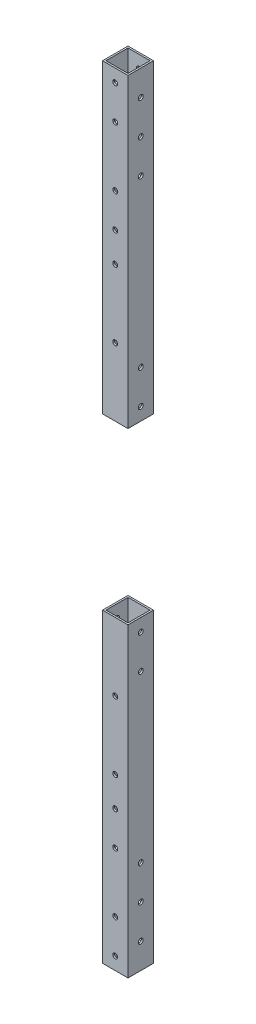
from build123d import *

# Parameters (mm, degrees)
SKETCH_1_W          = 15
SKETCH_1_H          = 15
SKETCH_1_W_2        = 13
SKETCH_1_H_2        = 13
EXTRUDE_1_DEPTH     = 460
SKETCH_2_R          = 1.45
CUT_EXTRUDE_1_DEPTH = 461.305605006
SKETCH_3_R          = 1.45
CUT_EXTRUDE_2_DEPTH = 461.305605006
SKETCH_4_W          = 15
SKETCH_4_H          = 100
CUT_EXTRUDE_3_DEPTH = 461.305605006


with BuildPart() as part:
    # 草图1 → 拉伸-薄壁1 (new body)
    with BuildSketch(Plane(origin=(0, 0, 0), x_dir=(1, 0, 0), z_dir=(0, 1, 0))):
        Rectangle(SKETCH_1_W, SKETCH_1_H)
        Rectangle(SKETCH_1_W_2, SKETCH_1_H_2, mode=Mode.SUBTRACT)
    extrude(amount=EXTRUDE_1_DEPTH)

    # 草图2 → 切除-拉伸1 (cut, through all)
    with BuildSketch(Plane.XY.offset(7.5)):
        with Locations((0, 7.5)):
            Circle(SKETCH_2_R)
        with Locations((0, 27.5)):
            Circle(SKETCH_2_R)
        with Locations(Location((0, 432.5, 0), (0, 0, 180))):
            Circle(SKETCH_2_R)
        with Locations(Location((0, 452.5, 0), (0, 0, 180))):
            Circle(SKETCH_2_R)
        with Locations((0, 62.5)):
            Circle(SKETCH_2_R)
        with Locations((0, 82.5)):
            Circle(SKETCH_2_R)
        with Locations(Location((0, 377.5, 0), (0, 0, 180))):
            Circle(SKETCH_2_R)
        with Locations(Location((0, 397.5, 0), (0, 0, 180))):
            Circle(SKETCH_2_R)
        with Locations((0, 140)):
            Circle(SKETCH_2_R)
        with Locations((0, 100)):
            Circle(SKETCH_2_R)
        with Locations(Location((0, 360, 0), (0, 0, 180))):
            Circle(SKETCH_2_R)
        with Locations(Location((0, 320, 0), (0, 0, 180))):
            Circle(SKETCH_2_R)
    extrude(amount=-CUT_EXTRUDE_1_DEPTH, mode=Mode.SUBTRACT)

    # 草图3 → 切除-拉伸2 (cut, through all)
    with BuildSketch(Plane(origin=(7.5, 0, 0), x_dir=(0, 0, -1), z_dir=(1, 0, 0))):
        with Locations((0, 15)):
            Circle(SKETCH_3_R)
        with Locations((0, 35)):
            Circle(SKETCH_3_R)
        with Locations((0, 425)):
            Circle(SKETCH_3_R)
        with Locations((0, 445)):
            Circle(SKETCH_3_R)
        with Locations((0, 172.5)):
            Circle(SKETCH_3_R)
        with Locations((0, 192.5)):
            Circle(SKETCH_3_R)
        with Locations((0, 152.5)):
            Circle(SKETCH_3_R)
        with Locations((0, 307.5)):
            Circle(SKETCH_3_R)
        with Locations((0, 267.5)):
            Circle(SKETCH_3_R)
        with Locations((0, 287.5)):
            Circle(SKETCH_3_R)
        with Locations((0, 55)):
            Circle(SKETCH_3_R)
        with Locations((0, 405)):
            Circle(SKETCH_3_R)
    extrude(amount=-CUT_EXTRUDE_2_DEPTH, mode=Mode.SUBTRACT)

    # 草图4 → 切除-拉伸3 (cut, through all)
    with BuildSketch(Plane(origin=(7.5, 0, 0), x_dir=(0, 0, -1), z_dir=(1, 0, 0))):
        with Locations((0, 230)):
            Rectangle(SKETCH_4_W, SKETCH_4_H)
    extrude(amount=-CUT_EXTRUDE_3_DEPTH, mode=Mode.SUBTRACT)


with BuildPart() as cut_extrude_3_piece_1:
    # of the separate pieces the step leaves, piece 1, a body of its own (cut_extrude_3_pieces)
    add(part.part.solids().sort_by_distance((7.5, 280, -7.5))[0])


with BuildPart() as cut_extrude_3_piece_2:
    # of the separate pieces the step leaves, piece 2, a body of its own (cut_extrude_3_pieces)
    add(part.part.solids().sort_by_distance((7.5, 0, -7.5))[0])


solid = Compound([cut_extrude_3_piece_1.part, cut_extrude_3_piece_2.part])
